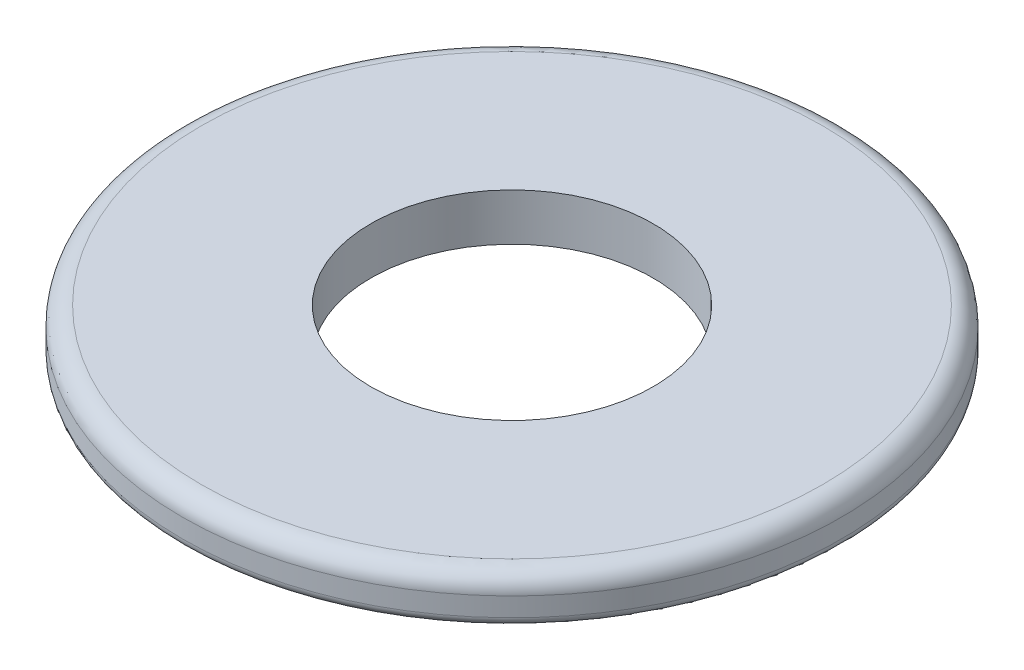
from build123d import *

# Parameters (mm, degrees)
SKETCH1_R           = 3.5
SKETCH1_R_2         = 1.5
BOSS_EXTRUDE1_DEPTH = 0.5
FILLET1_R           = 0.2
FILLET2_R           = 0.1


with BuildPart() as part:
    # Sketch1 → Boss-Extrude1 (new body)
    with BuildSketch(Plane(origin=(0, 0, 0), x_dir=(1, 0, 0), z_dir=(0, 1, 0))):
        with Locations(Location((0, 0, 0), (0, 0, 270))):
            Circle(SKETCH1_R)
        with Locations(Location((0, 0, 0), (0, 0, 270))):
            Circle(SKETCH1_R_2, mode=Mode.SUBTRACT)
    extrude(amount=BOSS_EXTRUDE1_DEPTH)

    # Fillet1
    fillet1_edges = [part.edges().sort_by_distance(p)[0] for p in [
        (0, 0.5, -3.5),
    ]]
    fillet(fillet1_edges, radius=FILLET1_R)

    # Fillet2
    fillet2_edges = [part.edges().sort_by_distance(p)[0] for p in [
        (0, 0, -3.5),
    ]]
    fillet(fillet2_edges, radius=FILLET2_R)


solid = part.part
